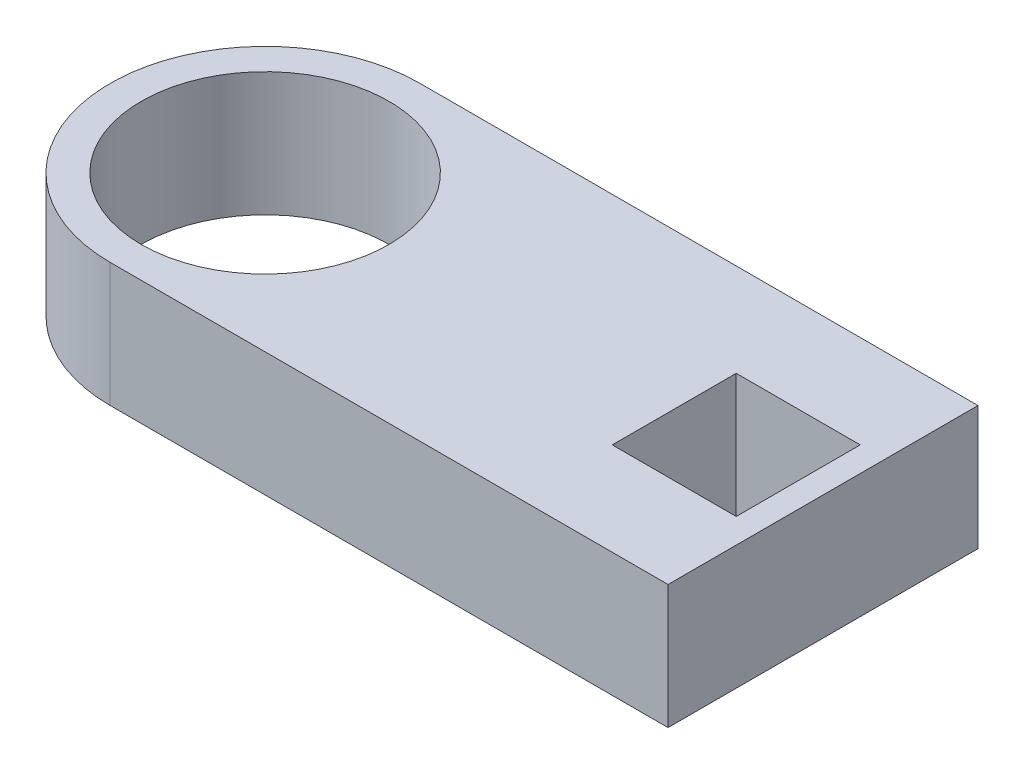
from build123d import *

# Parameters (mm, degrees)
SKETCH1_R           = 10
SKETCH1_W           = 10
SKETCH1_H           = 10
BOSS_EXTRUDE1_DEPTH = 10


with BuildPart() as part:
    # Sketch1 → Boss-Extrude1 (new body)
    with BuildSketch(Plane(origin=(0, 0, 0), x_dir=(1, 0, 0), z_dir=(0, 1, 0))):
        with BuildLine():
            Line((0, 0), (45, 0))
            Line((45, 0), (45, 25))
            Line((45, 25), (0, 25))
            ThreePointArc((0, 25), (-12.5, 12.5), (0, 0))
        make_face()
        with Locations(Location((0, 12.5, 0), (0, 0, 270))):
            Circle(SKETCH1_R, mode=Mode.SUBTRACT)
        with Locations((38, 12.5)):
            Rectangle(SKETCH1_W, SKETCH1_H, mode=Mode.SUBTRACT)
    extrude(amount=BOSS_EXTRUDE1_DEPTH)


solid = part.part
